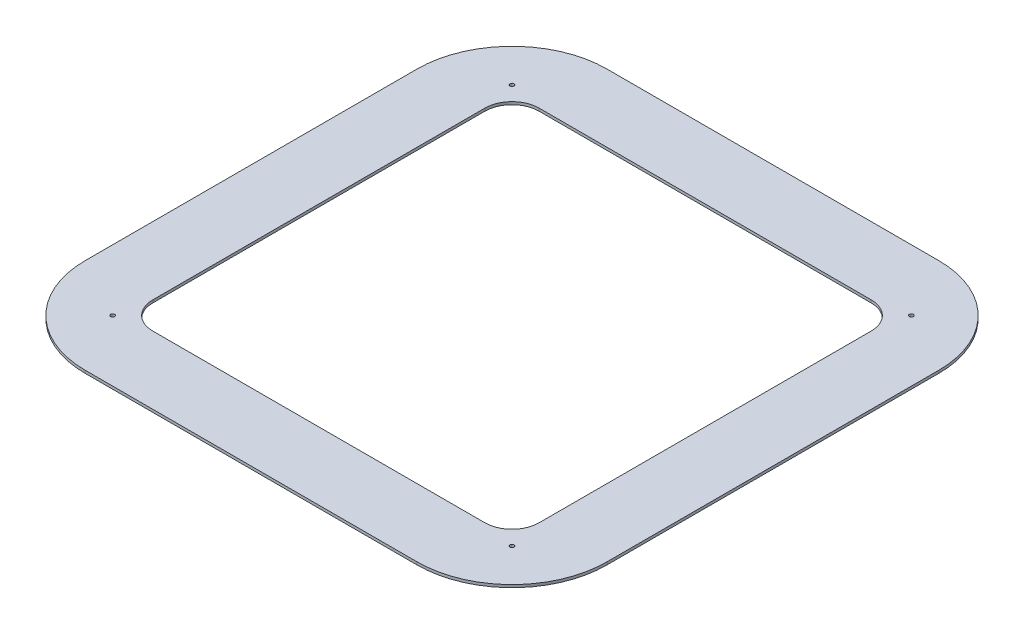
from build123d import *

# Parameters (mm, degrees)
SKETCH_1_W          = 385
SKETCH_1_H          = 385
SKETCH_1_W_2        = 285
SKETCH_1_H_2        = 285
EXTRUDE_1_DEPTH     = 2
FILLET_1_R          = 70
FILLET_2_R          = 20
CUT_EXTRUDE_1_REACH = 546.476
SKETCH_2_R          = 1.5


with BuildPart() as part:
    # 草图1 → 凸台-拉伸1 (new body)
    with BuildSketch(Plane(origin=(0, 0, 0), x_dir=(1, 0, 0), z_dir=(0, 1, 0))):
        with Locations((192.5, 192.5)):
            Rectangle(SKETCH_1_W, SKETCH_1_H)
        with Locations((192.5, 192.5)):
            Rectangle(SKETCH_1_W_2, SKETCH_1_H_2, mode=Mode.SUBTRACT)
    extrude(amount=EXTRUDE_1_DEPTH)

    # 圆角1
    fillet_1_edges = [part.edges().sort_by_distance(p)[0] for p in [
        (0, 1, -385),
        (385, 1, -385),
        (385, 1, 0),
        (0, 1, 0),
    ]]
    fillet(fillet_1_edges, radius=FILLET_1_R)

    # 圆角2
    fillet_2_edges = [part.edges().sort_by_distance(p)[0] for p in [
        (50, 1, -335),
        (50, 1, -50),
        (335, 1, -50),
        (335, 1, -335),
    ]]
    fillet(fillet_2_edges, radius=FILLET_2_R)

    # 草图2 → 切除-拉伸1 (cut, up to next)
    with BuildSketch(Plane(origin=(0, 2, 0), x_dir=(1, 0, 0), z_dir=(0, 1, 0)), mode=Mode.PRIVATE) as cut_extrude_1_sk1:
        with Locations(Location((45.18055198, 45.18055198, 0), (0, 0, 270))):
            Circle(SKETCH_2_R)
    cut_extrude_1_tool1 = extrude(cut_extrude_1_sk1.sketch, amount=-CUT_EXTRUDE_1_REACH, mode=Mode.PRIVATE) & part.part
    # 草图2 → 切除-拉伸1 (cut, up to next)
    with BuildSketch(Plane(origin=(0, 2, 0), x_dir=(1, 0, 0), z_dir=(0, 1, 0)), mode=Mode.PRIVATE) as cut_extrude_1_sk2:
        with BuildLine():
            ThreePointArc((46.68055198, 339.81944802), (45.754577129, 341.205267318), (44.119891809, 340.880108191))
            Line((44.119891809, 340.880108191), (46.241212152, 338.758787848))
            ThreePointArc((46.241212152, 338.758787848), (46.566371279, 339.245422871), (46.68055198, 339.81944802))
        make_face()
    cut_extrude_1_tool2 = extrude(cut_extrude_1_sk2.sketch, amount=-CUT_EXTRUDE_1_REACH, mode=Mode.PRIVATE) & part.part
    # 草图2 → 切除-拉伸1 (cut, up to next)
    with BuildSketch(Plane(origin=(0, 2, 0), x_dir=(1, 0, 0), z_dir=(0, 1, 0)), mode=Mode.PRIVATE) as cut_extrude_1_sk3:
        with BuildLine():
            Line((46.241212152, 338.758787848), (44.119891809, 340.880108191))
            ThreePointArc((44.119891809, 340.880108191), (44.119891809, 338.758787848), (46.241212152, 338.758787848))
        make_face()
    cut_extrude_1_tool3 = extrude(cut_extrude_1_sk3.sketch, amount=-CUT_EXTRUDE_1_REACH, mode=Mode.PRIVATE) & part.part
    # 草图2 → 切除-拉伸1 (cut, up to next)
    with BuildSketch(Plane(origin=(0, 2, 0), x_dir=(1, 0, 0), z_dir=(0, 1, 0)), mode=Mode.PRIVATE) as cut_extrude_1_sk4:
        with BuildLine():
            ThreePointArc((46.68055198, 339.81944802), (45.754577129, 341.205267318), (44.119891809, 340.880108191))
            Line((44.119891809, 340.880108191), (46.241212152, 338.758787848))
            ThreePointArc((46.241212152, 338.758787848), (46.566371279, 339.245422871), (46.68055198, 339.81944802))
        make_face()
    cut_extrude_1_tool4 = extrude(cut_extrude_1_sk4.sketch, amount=-CUT_EXTRUDE_1_REACH, mode=Mode.PRIVATE) & part.part
    # 草图2 → 切除-拉伸1 (cut, up to next)
    with BuildSketch(Plane(origin=(0, 2, 0), x_dir=(1, 0, 0), z_dir=(0, 1, 0)), mode=Mode.PRIVATE) as cut_extrude_1_sk5:
        with BuildLine():
            Line((46.241212152, 338.758787848), (44.119891809, 340.880108191))
            ThreePointArc((44.119891809, 340.880108191), (44.119891809, 338.758787848), (46.241212152, 338.758787848))
        make_face()
    cut_extrude_1_tool5 = extrude(cut_extrude_1_sk5.sketch, amount=-CUT_EXTRUDE_1_REACH, mode=Mode.PRIVATE) & part.part
    # 草图2 → 切除-拉伸1 (cut, up to next)
    with BuildSketch(Plane(origin=(0, 2, 0), x_dir=(1, 0, 0), z_dir=(0, 1, 0)), mode=Mode.PRIVATE) as cut_extrude_1_sk6:
        with Locations(Location((339.81944802, 339.81944802, 0), (0, 0, 270))):
            Circle(SKETCH_2_R)
    cut_extrude_1_tool6 = extrude(cut_extrude_1_sk6.sketch, amount=-CUT_EXTRUDE_1_REACH, mode=Mode.PRIVATE) & part.part
    # 草图2 → 切除-拉伸1 (cut, up to next)
    with BuildSketch(Plane(origin=(0, 2, 0), x_dir=(1, 0, 0), z_dir=(0, 1, 0)), mode=Mode.PRIVATE) as cut_extrude_1_sk7:
        with Locations(Location((339.81944802, 45.18055198, 0), (0, 0, 270))):
            Circle(SKETCH_2_R)
    cut_extrude_1_tool7 = extrude(cut_extrude_1_sk7.sketch, amount=-CUT_EXTRUDE_1_REACH, mode=Mode.PRIVATE) & part.part
    add(cut_extrude_1_tool1.solids().sort_by_distance((45.180552, 2, -45.180552))[0], mode=Mode.SUBTRACT)
    add(cut_extrude_1_tool2.solids().sort_by_distance((45.63071, 2, -340.269606))[0], mode=Mode.SUBTRACT)
    add(cut_extrude_1_tool3.solids().sort_by_distance((44.730394, 2, -339.36929))[0], mode=Mode.SUBTRACT)
    add(cut_extrude_1_tool4.solids().sort_by_distance((45.63071, 2, -340.269606))[0], mode=Mode.SUBTRACT)
    add(cut_extrude_1_tool5.solids().sort_by_distance((44.730394, 2, -339.36929))[0], mode=Mode.SUBTRACT)
    add(cut_extrude_1_tool6.solids().sort_by_distance((339.819448, 2, -339.819448))[0], mode=Mode.SUBTRACT)
    add(cut_extrude_1_tool7.solids().sort_by_distance((339.819448, 2, -45.180552))[0], mode=Mode.SUBTRACT)


solid = part.part
